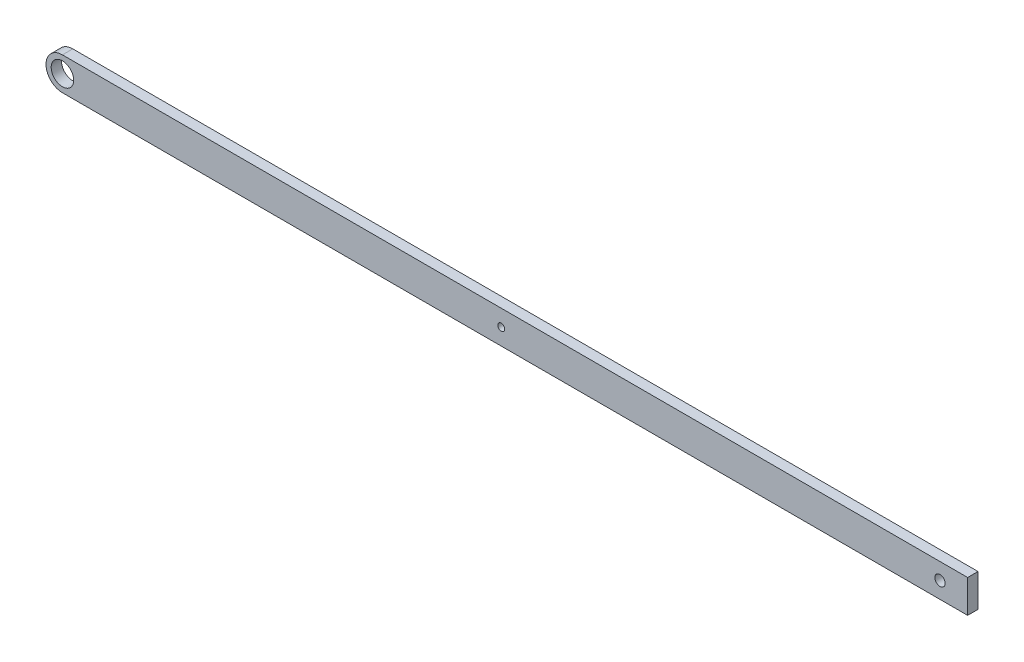
from build123d import *

# Parameters (mm, degrees)
BOSS_EXTRUDE1_DEPTH = 1.5
SKETCH2_R           = 3.25
SKETCH2_R_2         = 1
SKETCH2_R_3         = 1.5
CUT_EXTRUDE1_DEPTH  = 20


with BuildPart() as part:
    # Sketch1 → Boss-Extrude1 (new, symmetric)
    with BuildSketch(Plane.XY):
        with BuildLine():
            Line((0, -4.75), (262, -4.75))
            Line((262, -4.75), (262, 4.75))
            Line((262, 4.75), (0, 4.75))
            ThreePointArc((0, 4.75), (-4.75, 0), (0, -4.75))
        make_face()
    extrude(amount=BOSS_EXTRUDE1_DEPTH, both=True)

    # Sketch2 → Cut-Extrude1 (cut, symmetric)
    with BuildSketch(Plane.XY):
        Circle(SKETCH2_R)
        with Locations((127, 0)):
            Circle(SKETCH2_R_2)
        with Locations((254, 0)):
            Circle(SKETCH2_R_3)
    extrude(amount=CUT_EXTRUDE1_DEPTH, both=True, mode=Mode.SUBTRACT)


solid = part.part
